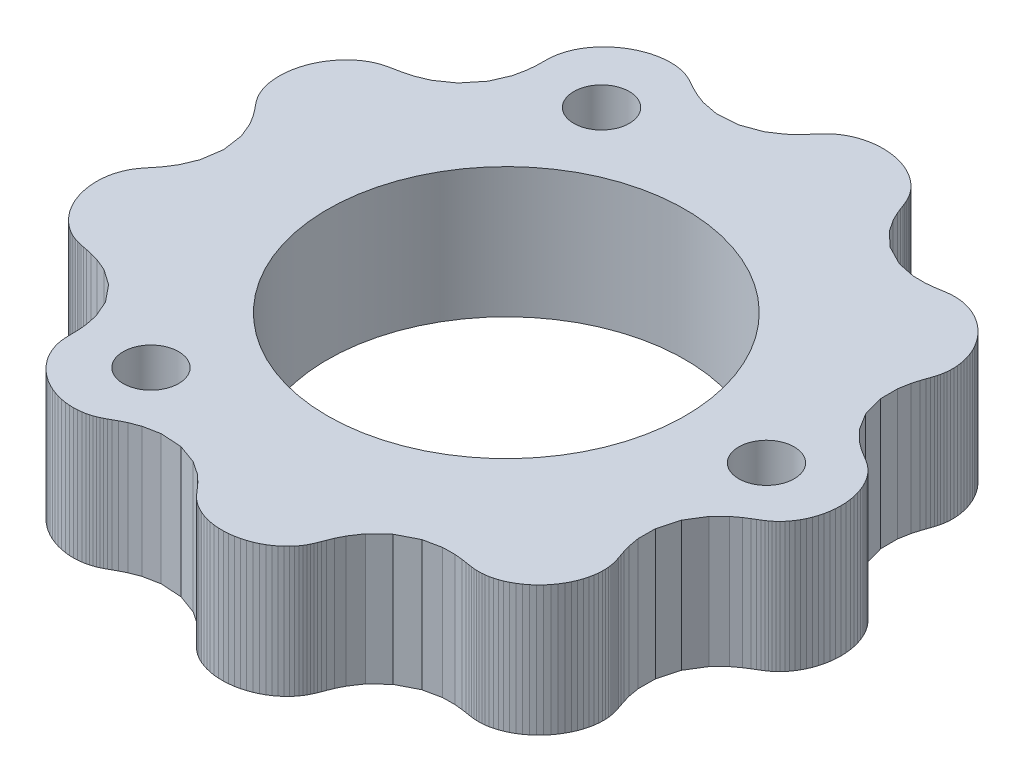
from build123d import *

# Parameters (mm, degrees)
SKETCH1_R           = 8.73125
BOSS_EXTRUDE1_DEPTH = 6.35
SKETCH2_R           = 1.35255
CUT_EXTRUDE1_DEPTH  = 25.155143673


with BuildPart() as part:
    # Sketch1 → Boss-Extrude1 (new body)
    with BuildSketch(Plane(origin=(0, 0, 0), x_dir=(1, 0, 0), z_dir=(0, 1, 0))):
        Polygon((13.158625694, 2.896830869), (12.791263425, 3.170142616), (12.291349818, 3.669343614), (11.77870952, 4.496612993), (11.502906417, 5.500558598), (11.499130591, 6.333845387), (11.598412818, 6.883171823), (11.697750704, 7.22707793), (11.774159157, 7.453194447), (11.830874176, 7.617056094), (11.874650737, 7.750735367), (11.910311798, 7.872982033), (11.94024632, 7.995078537), (11.964947846, 8.123889112), (11.983624956, 8.263460612), (11.994696284, 8.415902035), (11.996165513, 8.58190094), (11.985903403, 8.761053922), (11.961861475, 8.952100578), (11.922234402, 9.15310695), (11.865582106, 9.361622282), (11.790918419, 9.574821298), (11.69777069, 9.789637839), (11.586213208, 10.002892144), (11.456876573, 10.211411964), (11.310934746, 10.412146557), (11.150071414, 10.602271901), (10.976427312, 10.779285127), (10.792530246, 10.941086065), (10.601209599, 11.086043732), (10.40549712, 11.21304574), (10.208515647, 11.32152862), (10.013357043, 11.411487218), (9.82294991, 11.483461233), (9.639916308, 11.53849685), (9.466414428, 11.578080931), (9.30396013, 11.604044362), (9.153213125, 11.618429715), (9.013700532, 11.623316296), (8.883425976, 11.620593564), (8.758264909, 11.6116747), (8.630953094, 11.597157727), (8.489288819, 11.576514925), (8.312816024, 11.548173385), (8.066774888, 11.511359518), (7.692825719, 11.474374893), (7.106780789, 11.481262171), (6.260742916, 11.657086194), (5.327653237, 12.13682498), (4.639141336, 12.78973614), (4.263548607, 13.350931054), (4.072540039, 13.74249338), (3.96571592, 14.00500093), (3.895355597, 14.189369897), (3.840055292, 14.331162601), (3.78908175, 14.4523302), (3.735998369, 14.565875167), (3.676260973, 14.679167745), (3.606331959, 14.795973888), (3.523370431, 14.917683018), (3.425141503, 15.044078008), (3.310005363, 15.173845889), (3.176929193, 15.304939372), (3.025497932, 15.434849523), (2.855913644, 15.56082269), (2.668979383, 15.680039768), (2.466066333, 15.789767513), (2.249064552, 15.887486884), (2.020318509, 15.97100072), (1.782549186, 16.03852155), (1.538764919, 16.088739506), (1.292163415, 16.120869989), (1.046027604, 16.134680539), (0.803618049, 16.130496436), (0.568064656, 16.109184558), (0.342260296, 16.072115088), (0.128758713, 16.021100558), (-0.070321364, 15.95831139), (-0.25338471, 15.886166371), (-0.419440656, 15.807195119), (-0.568178667, 15.723867047), (-0.700043841, 15.638376887), (-0.816324214, 15.552369091), (-0.919274444, 15.466569786), (-1.012326753, 15.380271393), (-1.100497133, 15.29057548), (-1.191224754, 15.191240524), (-1.296190042, 15.070928162), (-1.435378112, 14.910789352), (-1.646084076, 14.682725665), (-2.000012249, 14.356636581), (-2.613301094, 13.945903473), (-3.547999163, 13.604802593), (-4.575306363, 13.541411116), (-5.361953094, 13.696601946), (-5.857746817, 13.887956118), (-6.162987487, 14.040370311), (-6.363853429, 14.150825572), (-6.511128594, 14.232604381), (-6.633373325, 14.297501726), (-6.747227712, 14.353063522), (-6.862833226, 14.403257917), (-6.986525121, 14.449529229), (-7.122199157, 14.491649229), (-7.272041556, 14.528334005), (-7.436947664, 14.557686634), (-7.616786074, 14.577521332), (-7.810585812, 14.585606925), (-8.016685841, 14.579853108), (-8.232866897, 14.558453609), (-8.456475656, 14.519994651), (-8.684545759, 14.463533736), (-8.913917171, 14.388651827), (-9.141353569, 14.295480952), (-9.363656383, 14.184708755), (-9.577773559, 14.05756128), (-9.780900751, 13.915765289), (-9.970572544, 13.761491449), (-10.144741292, 13.597279778), (-10.301841251, 13.425948779), (-10.440835788, 13.250489495), (-10.561245616, 13.073945381), (-10.663156095, 12.89927809), (-10.747201692, 12.729217869), (-10.81452563, 12.566094758), (-10.866712592, 12.411642411), (-10.905692153, 12.266758579), (-10.933610967, 12.13119217), (-10.952674341, 12.003100465), (-10.964968267, 11.878369921), (-10.972309201, 11.749497674), (-10.976288171, 11.603647792), (-10.979061961, 11.419183026), (-10.986666406, 11.159717242), (-11.020081461, 10.766496124), (-11.144274781, 10.16421872), (-11.497556725, 9.343084609), (-12.161374156, 8.525342821), (-12.918032965, 7.99800603), (-13.512853147, 7.749296534), (-13.91254669, 7.63914869), (-14.177831781, 7.583264075), (-14.365091893, 7.547321403), (-14.511050114, 7.517816519), (-14.637879771, 7.488456876), (-14.758703456, 7.455312864), (-14.881069396, 7.415243397), (-15.008976339, 7.365449518), (-15.144066548, 7.303406745), (-15.286361475, 7.226916435), (-15.434745313, 7.134184503), (-15.58730681, 7.023894503), (-15.741598733, 6.895263384), (-15.894847072, 6.748076118), (-16.044127287, 6.58269853), (-16.186516651, 6.400068908), (-16.319227166, 6.201669636), (-16.439720885, 5.989480459), (-16.545807973, 5.765915285), (-16.635727085, 5.533744701), (-16.708207199, 5.296006556), (-16.762509962, 5.055907141), (-16.798451558, 4.816715583), (-16.816403204, 4.581654056), (-16.817269391, 4.353786303), (-16.80244296, 4.135906655), (-16.773735786, 3.930431239), (-16.733283256, 3.739292143), (-16.683419422, 3.56383386), (-16.626517462, 3.404708787), (-16.56478603, 3.261764073), (-16.500005161, 3.133903861), (-16.43317353, 3.0188949), (-16.364019144, 2.913050998), (-16.290295373, 2.810663059), (-16.206749366, 2.702890306), (-16.103662751, 2.575486665), (-15.96520381, 2.403995134), (-15.769763324, 2.143864402), (-15.502439396, 1.714513582), (-15.207563438, 1.003228947), (-15.061665617, 0), (-15.207563438, -1.003228947), (-15.502439396, -1.714513582), (-15.769763324, -2.143864402), (-15.96520381, -2.403995134), (-16.103662751, -2.575486665), (-16.206749366, -2.702890306), (-16.290295373, -2.810663059), (-16.364019144, -2.913050998), (-16.43317353, -3.0188949), (-16.500005161, -3.133903861), (-16.56478603, -3.261764073), (-16.626517462, -3.404708787), (-16.683419422, -3.56383386), (-16.733283256, -3.739292143), (-16.773735786, -3.930431239), (-16.80244296, -4.135906655), (-16.817269391, -4.353786303), (-16.816403204, -4.581654056), (-16.798451558, -4.816715583), (-16.762509962, -5.055907141), (-16.708207199, -5.296006556), (-16.635727085, -5.533744701), (-16.545807973, -5.765915285), (-16.439720885, -5.989480459), (-16.319227166, -6.201669636), (-16.186516651, -6.400068908), (-16.044127287, -6.58269853), (-15.894847072, -6.748076118), (-15.741598733, -6.895263384), (-15.58730681, -7.023894503), (-15.434745313, -7.134184503), (-15.286361475, -7.226916435), (-15.144066548, -7.303406745), (-15.008976339, -7.365449518), (-14.881069396, -7.415243397), (-14.758703456, -7.455312864), (-14.637879771, -7.488456876), (-14.511050114, -7.517816519), (-14.365091893, -7.547321403), (-14.177831781, -7.583264075), (-13.91254669, -7.63914869), (-13.512853147, -7.749296534), (-12.918032965, -7.99800603), (-12.161374156, -8.525342821), (-11.497556725, -9.343084609), (-11.144274781, -10.16421872), (-11.020081461, -10.766496124), (-10.986666406, -11.159717242), (-10.979061961, -11.419183026), (-10.976288171, -11.603647792), (-10.972309201, -11.749497674), (-10.964968267, -11.878369921), (-10.952674341, -12.003100465), (-10.933610967, -12.13119217), (-10.905692153, -12.266758579), (-10.866712592, -12.411642411), (-10.81452563, -12.566094758), (-10.747201692, -12.729217869), (-10.663156095, -12.89927809), (-10.561245616, -13.073945381), (-10.440835788, -13.250489495), (-10.301841251, -13.425948779), (-10.144741292, -13.597279778), (-9.970572544, -13.761491449), (-9.780900751, -13.915765289), (-9.577773559, -14.05756128), (-9.363656383, -14.184708755), (-9.141353569, -14.295480952), (-8.913917171, -14.388651827), (-8.684545759, -14.463533736), (-8.456475656, -14.519994651), (-8.232866897, -14.558453609), (-8.016685841, -14.579853108), (-7.810585812, -14.585606925), (-7.616786074, -14.577521332), (-7.436947664, -14.557686634), (-7.272041556, -14.528334005), (-7.122199157, -14.491649229), (-6.986525121, -14.449529229), (-6.862833226, -14.403257917), (-6.747227712, -14.353063522), (-6.633373325, -14.297501726), (-6.511128594, -14.232604381), (-6.363853429, -14.150825572), (-6.162987487, -14.040370311), (-5.857746817, -13.887956118), (-5.361953094, -13.696601946), (-4.575306363, -13.541411116), (-3.547999163, -13.604802593), (-2.613301094, -13.945903473), (-2.000012249, -14.356636581), (-1.646084076, -14.682725665), (-1.435378112, -14.910789352), (-1.296190042, -15.070928162), (-1.191224754, -15.191240524), (-1.100497133, -15.29057548), (-1.012326753, -15.380271393), (-0.919274444, -15.466569786), (-0.816324214, -15.552369091), (-0.700043841, -15.638376887), (-0.568178667, -15.723867047), (-0.419440656, -15.807195119), (-0.25338471, -15.886166371), (-0.070321364, -15.95831139), (0.128758713, -16.021100558), (0.342260296, -16.072115088), (0.568064656, -16.109184558), (0.803618049, -16.130496436), (1.046027604, -16.134680539), (1.292163415, -16.120869989), (1.538764919, -16.088739506), (1.782549186, -16.03852155), (2.020318509, -15.97100072), (2.249064552, -15.887486884), (2.466066333, -15.789767513), (2.668979383, -15.680039768), (2.855913644, -15.56082269), (3.025497932, -15.434849523), (3.176929193, -15.304939372), (3.310005363, -15.173845889), (3.425141503, -15.044078008), (3.523370431, -14.917683018), (3.606331959, -14.795973888), (3.676260973, -14.679167745), (3.735998369, -14.565875167), (3.78908175, -14.4523302), (3.840055292, -14.331162601), (3.895355597, -14.189369897), (3.96571592, -14.00500093), (4.072540039, -13.74249338), (4.263548607, -13.350931054), (4.639141336, -12.78973614), (5.327653237, -12.13682498), (6.260742916, -11.657086194), (7.106780789, -11.481262171), (7.692825719, -11.474374893), (8.066774888, -11.511359518), (8.312816024, -11.548173385), (8.489288819, -11.576514925), (8.630953094, -11.597157727), (8.758264909, -11.6116747), (8.883425976, -11.620593564), (9.013700532, -11.623316296), (9.153213125, -11.618429715), (9.30396013, -11.604044362), (9.466414428, -11.578080931), (9.639916308, -11.53849685), (9.82294991, -11.483461233), (10.013357043, -11.411487218), (10.208515647, -11.32152862), (10.40549712, -11.21304574), (10.601209599, -11.086043732), (10.792530246, -10.941086065), (10.976427312, -10.779285127), (11.150071414, -10.602271901), (11.310934746, -10.412146557), (11.456876573, -10.211411964), (11.586213208, -10.002892144), (11.69777069, -9.789637839), (11.790918419, -9.574821298), (11.865582106, -9.361622282), (11.922234402, -9.15310695), (11.961861475, -8.952100578), (11.985903403, -8.761053922), (11.996165513, -8.58190094), (11.994696284, -8.415902035), (11.983624956, -8.263460612), (11.964947846, -8.123889112), (11.94024632, -7.995078537), (11.910311798, -7.872982033), (11.874650737, -7.750735367), (11.830874176, -7.617056094), (11.774159157, -7.453194447), (11.697750704, -7.22707793), (11.598412818, -6.883171823), (11.499130591, -6.333845387), (11.502906417, -5.500558598), (11.77870952, -4.496612993), (12.291349818, -3.669343614), (12.791263425, -3.170142616), (13.158625694, -2.896830869), (13.408930458, -2.73784625), (13.584341614, -2.632733463), (13.717588449, -2.552044195), (13.829541203, -2.480428751), (13.932622305, -2.408840541), (14.033773805, -2.331288733), (14.136398272, -2.243489494), (14.241574904, -2.142296138), (14.348837786, -2.025454435), (14.45669787, -1.891494238), (14.563013637, -1.739675236), (14.665269391, -1.56994962), (14.760794066, -1.382924429), (14.846938825, -1.179815696), (14.921223434, -0.962391162), (14.981456788, -0.732900817), (15.025834231, -0.493995911), (15.053012917, -0.248637985), (15.062165593, 0), (15.053012917, 0.248637985), (15.025834231, 0.493995911), (14.981456788, 0.732900817), (14.921223434, 0.962391162), (14.846938825, 1.179815696), (14.760794066, 1.382924429), (14.665269391, 1.56994962), (14.563013637, 1.739675236), (14.45669787, 1.891494238), (14.348837786, 2.025454435), (14.241574904, 2.142296138), (14.136398272, 2.243489494), (14.033773805, 2.331288733), (13.932622305, 2.408840541), (13.829541203, 2.480428751), (13.717588449, 2.552044195), (13.584341614, 2.632733463), (13.408930458, 2.73784625), align=None)
        with Locations(Location((-1.27, 0, 0), (0, 0, 270))):
            Circle(SKETCH1_R, mode=Mode.SUBTRACT)
    extrude(amount=BOSS_EXTRUDE1_DEPTH)

    # Sketch2 → Cut-Extrude1 (cut, through all)
    with BuildSketch(Plane(origin=(0, 6.35, 0), x_dir=(1, 0, 0), z_dir=(0, 1, 0))):
        with Locations(Location((11.43, 0, 0), (0, 0, 270))):
            Circle(SKETCH2_R)
        with Locations(Location((-7.62, -10.998522628, 0), (0, 0, 270))):
            Circle(SKETCH2_R)
        with Locations(Location((-7.62, 10.998522628, 0), (0, 0, 270))):
            Circle(SKETCH2_R)
    extrude(amount=-CUT_EXTRUDE1_DEPTH, mode=Mode.SUBTRACT)


solid = part.part
